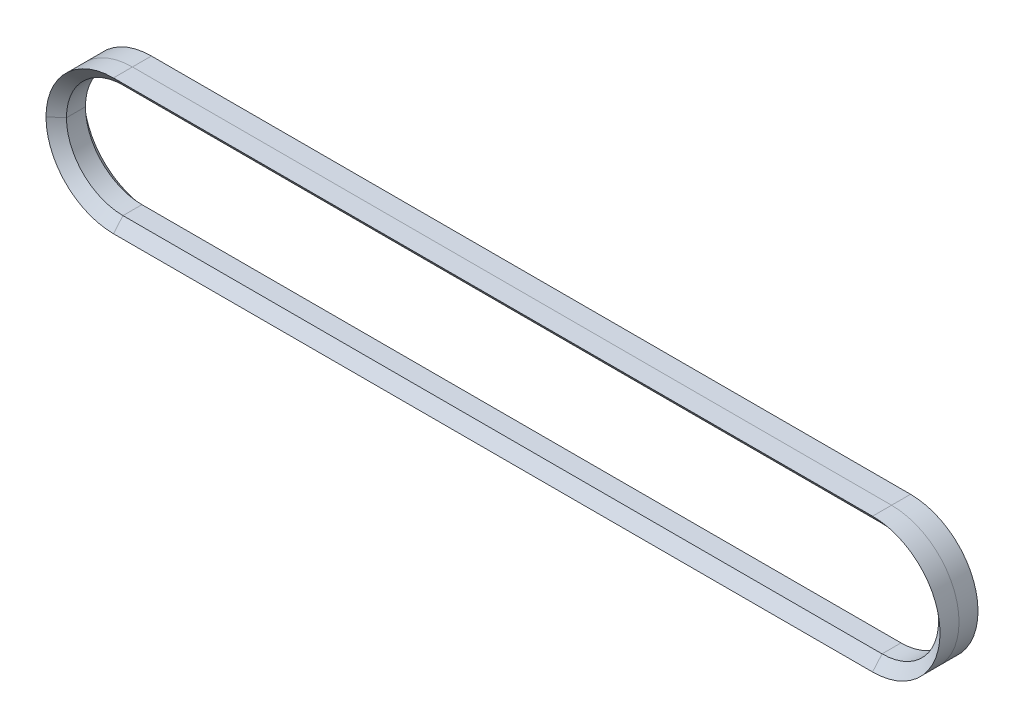
from build123d import *


with BuildPart() as part:
    # 扫描1: sweep along a path in 草图1
    with BuildLine(Plane.XY) as sweep_1_path:
        Line((-90, 16), (90, 16))
        ThreePointArc((90, 16), (106, 0), (90, -16))
        Line((90, -16), (-90, -16))
        ThreePointArc((-90, -16), (-106, 0), (-90, 16))
    # 草图2 → 扫描1 (sweep)
    with BuildSketch(Plane(origin=(0, 0, 0), x_dir=(1, 0, 0), z_dir=(0, 1, 0))):
        Polygon((-106, 0), (-106, 4.5), (-103.4, 2.25), (-103.4, -2.25), (-106, -4.5), align=None)
    sweep(path=sweep_1_path.line)


solid = part.part
